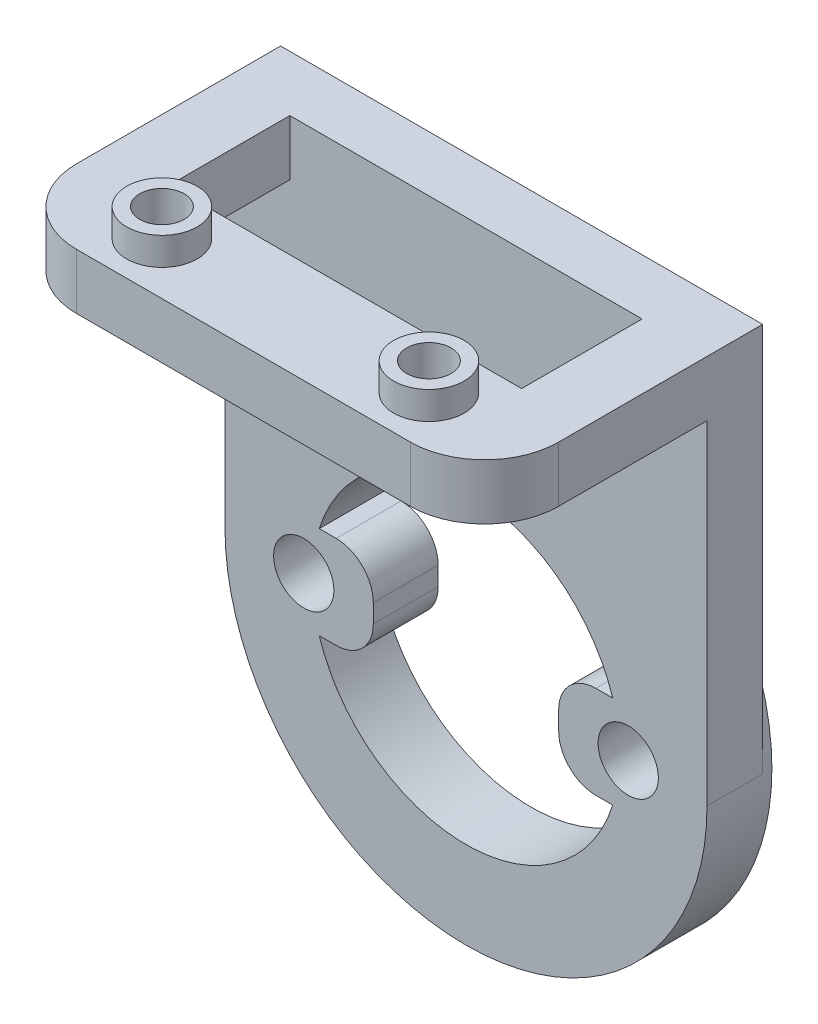
from build123d import *

# Parameters (mm, degrees)
ESBO_O1_R                = 13
ESBO_O1_R_2              = 8.3
RESSALTO_EXTRUS_O1_DEPTH = 3.5
RESSALTO_EXTRUS_O2_DEPTH = 3.5
ESBO_O4_R                = 1.625
CORTE_EXTRUS_O2_DEPTH    = 19.714967272
FILETE1_R                = 2
RESSALTO_EXTRUS_O4_START = -3
RESSALTO_EXTRUS_O4_DEPTH = 3
RESSALTO_EXTRUS_O5_DEPTH = 3
ESBO_O9_R                = 1.9
RESSALTO_EXTRUS_O6_DEPTH = 1.5
ESBO_O10_R               = 1.2
CORTE_EXTRUS_O3_DEPTH    = 41.859515416
CORTE_EXTRUS_O4_DEPTH    = 1.6
FILETE2_R                = 4


with BuildPart() as part:
    # Esboço1 → Ressalto-extrusão1 (new body)
    with BuildSketch(Plane.XY):
        Circle(ESBO_O1_R)
        Circle(ESBO_O1_R_2, mode=Mode.SUBTRACT)
    extrude(amount=RESSALTO_EXTRUS_O1_DEPTH)

    # Esboço3 → Ressalto-extrusão2 (add, through all)
    with BuildSketch(Plane.XY.offset(3.5)):
        with BuildLine():
            Line((-8.124038405, 2.5), (-5, 2.5))
            Line((-5, 2.5), (-5, -2.5))
            Line((-5, -2.5), (-8.124038405, -2.5))
            ThreePointArc((-8.124038405, -2.5), (-8.5, 0), (-8.124038405, 2.5))
        make_face()
        with BuildLine():
            Line((5, 2.5), (5, -2.5))
            Line((5, -2.5), (8.124038405, -2.5))
            ThreePointArc((8.124038405, -2.5), (8.5, 0), (8.124038405, 2.5))
            Line((8.124038405, 2.5), (5, 2.5))
        make_face()
    extrude(amount=-RESSALTO_EXTRUS_O2_DEPTH)

    # Esboço4 → Corte-extrusão2 (cut, through all)
    with BuildSketch(Plane.XY.offset(3.5)):
        with Locations((-8.75, 0)):
            Circle(ESBO_O4_R)
        with Locations(Location((8.75, 0, 0), (0, 0, 180))):
            Circle(ESBO_O4_R)
    extrude(amount=-CORTE_EXTRUS_O2_DEPTH, mode=Mode.SUBTRACT)

    # Filete1
    filete1_edges = [part.edges().sort_by_distance(p)[0] for p in [
        (-5, 2.5, 1.75),
        (-5, -2.5, 1.75),
        (5, -2.5, 1.75),
        (5, 2.5, 1.75),
    ]]
    fillet(filete1_edges, radius=FILETE1_R)

    # Esboço7 → Ressalto-extrusão4 (add)
    with BuildSketch(Plane.XY.offset(3.5).offset(RESSALTO_EXTRUS_O4_START)):
        with BuildLine():
            Line((-13, 0), (-13, 21))
            Line((-13, 21), (13, 21))
            Line((13, 21), (13, 0))
            ThreePointArc((13, 0), (0, 13), (-13, 0))
        make_face()
    extrude(amount=RESSALTO_EXTRUS_O4_DEPTH)

    # Esboço8 → Ressalto-extrusão5 (add)
    with BuildSketch(Plane(origin=(0, 21, 0), x_dir=(1, 0, 0), z_dir=(0, 1, 0))):
        Polygon((-13, -3.5), (-13, -15.5), (13, -15.5), (13, -3.5), (9.5, -3.5), (9.5, -10), (-9.5, -10), (-9.5, -3.5), align=None)
    extrude(amount=-RESSALTO_EXTRUS_O5_DEPTH)

    # Esboço9 → Ressalto-extrusão6 (add)
    with BuildSketch(Plane(origin=(0, 21, 0), x_dir=(1, 0, 0), z_dir=(0, 1, 0))):
        with Locations(Location((-7.2, -12.7, 0), (0, 0, 270))):
            Circle(ESBO_O9_R)
        with Locations(Location((7.2, -12.7, 0), (0, 0, 90))):
            Circle(ESBO_O9_R)
    extrude(amount=RESSALTO_EXTRUS_O6_DEPTH)

    # Esboço10 → Corte-extrusão3 (cut, through all)
    with BuildSketch(Plane(origin=(0, 22.5, 0), x_dir=(1, 0, 0), z_dir=(0, 1, 0))):
        with Locations(Location((-7.2, -12.7, 0), (0, 0, 270))):
            Circle(ESBO_O10_R)
        with Locations(Location((7.2, -12.7, 0), (0, 0, 270))):
            Circle(ESBO_O10_R)
    extrude(amount=-CORTE_EXTRUS_O3_DEPTH, mode=Mode.SUBTRACT)

    # Esboço11 → Corte-extrusão4 (cut)
    with BuildSketch(Plane.XZ.offset(-18)):
        Polygon((-4.94833395, 12.7), (-6.074166975, 14.65), (-8.325833025, 14.65), (-9.45166605, 12.7), (-8.325833025, 10.75), (-6.074166975, 10.75), align=None)
        Polygon((6.074166975, 10.75), (4.94833395, 12.7), (6.074166975, 14.65), (8.325833025, 14.65), (9.45166605, 12.7), (8.325833025, 10.75), align=None)
    extrude(amount=-CORTE_EXTRUS_O4_DEPTH, mode=Mode.SUBTRACT)

    # Filete2
    filete2_edges = [part.edges().sort_by_distance(p)[0] for p in [
        (13, 19.5, 15.5),
        (-13, 19.5, 15.5),
    ]]
    fillet(filete2_edges, radius=FILETE2_R)


solid = part.part
